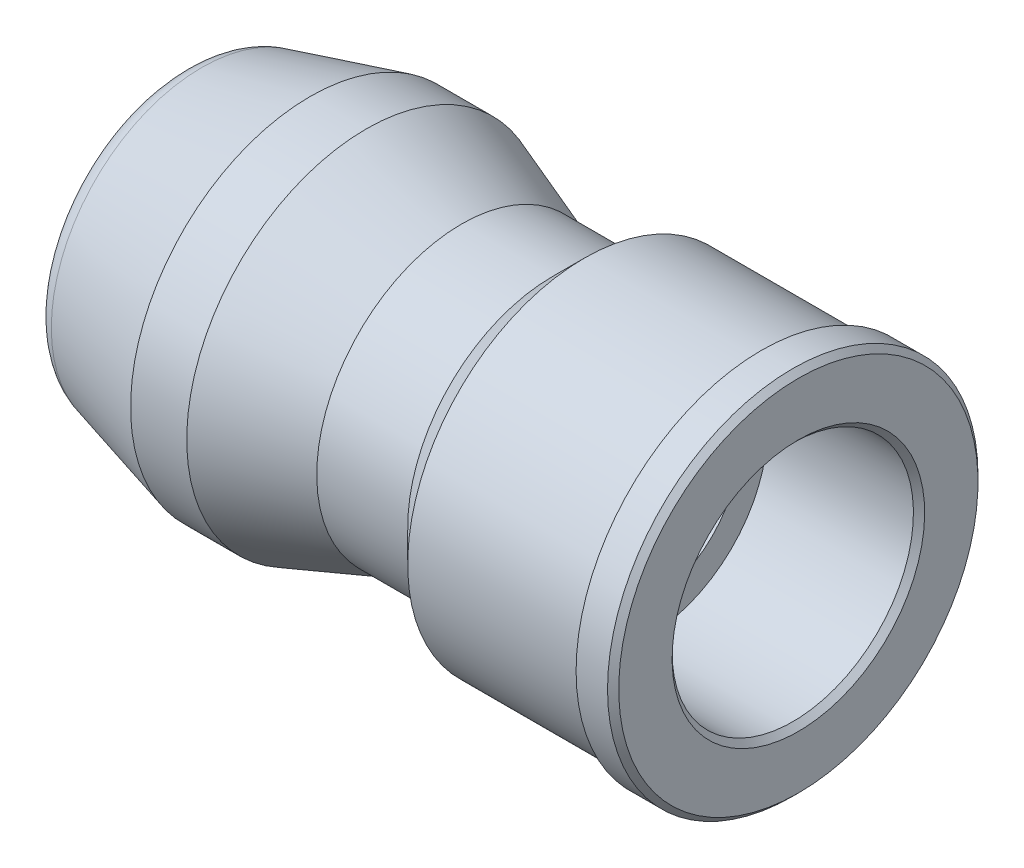
from build123d import *

# Parameters (mm, degrees)
M4_TAPPED_HOLE1_D           = 3.3
M4_TAPPED_HOLE1_CSINK_D     = 4.05
M4_TAPPED_HOLE1_CSINK_ANGLE = 45
FILLET1_R                   = 0.5
CHAMFER1_SIZE               = 0.1


with BuildPart() as part:
    # Sketch1 → Revolve1 (revolve)
    with BuildSketch(Plane.XY):
        Polygon((0, 0), (0, 2.58), (2.3, 3.196283143), (3.3, 3.196283143), (5, 2.58), (6.62, 2.58), (7.19, 3.15), (10.34, 3.15), (10.34, 3.3), (11, 3.3), (11, 2.15), (8.3, 2.15), (8.3, 0), align=None)
    revolve(axis=Axis((8.3, 0, 0), (-1, 0, 0)))

    # M4 Tapped Hole1 (through all)
    with Locations(Plane.ZY):
        with Locations((0, 0)):
            CounterSinkHole(M4_TAPPED_HOLE1_D / 2, M4_TAPPED_HOLE1_CSINK_D / 2, counter_sink_angle=M4_TAPPED_HOLE1_CSINK_ANGLE)

    # Fillet1
    fillet1_edges = [part.edges().sort_by_distance(p)[0] for p in [
        (0, -2.58, 0),
    ]]
    fillet(fillet1_edges, radius=FILLET1_R)

    # Chamfer1
    chamfer1_edges = [part.edges().sort_by_distance(p)[0] for p in [
        (11, -2.15, 0),
        (11, -3.3, 0),
        (10.34, -3.15, 0),
    ]]
    chamfer(chamfer1_edges, length=CHAMFER1_SIZE)


solid = part.part
